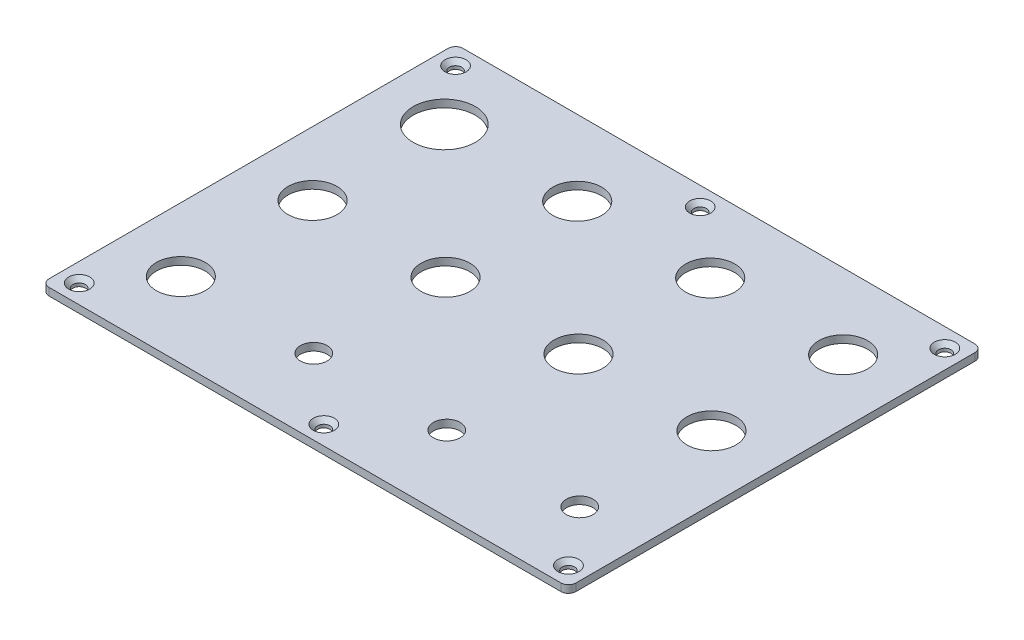
from build123d import *

# Parameters (mm, degrees)
BOTTOM_PLATE_W                       = 140
BOTTOM_PLATE_H                       = 110
BOTTOM_PLATE_EXT_DEPTH               = 2
TOP_ROW_R                            = 8.25
TOP_ROW_R_2                          = 6.5
TOP_ROW_CUT_DEPTH                    = 179.056170912
SKETCH2_R                            = 6.5
SKETCH2_R_2                          = 3.55
BOTTOM_ROW_CUT_DEPTH                 = 10
SKETCH3_R                            = 6.5
CENTER_ROW_CUT_DEPTH                 = 10
PLATE_SCREWS_R                       = 1.65
PLATE_SCREWS_CUT_DEPTH               = 179.056170912
PLATE_SCREW_HEAD_R                   = 2.8
PLATE_SCREW_HEAD_CUT_DEPTH           = 2
PLATE_SCREW_HEAD_CUT_DRAFT           = -45
PLATE_SCREW_HEAD_CUT_PROFILE_2_DEPTH = 2
PLATE_SCREW_HEAD_CUT_PROFILE_2_DRAFT = -45
PLATE_SCREW_HEAD_CUT_PROFILE_3_DEPTH = 2
PLATE_SCREW_HEAD_CUT_PROFILE_3_DRAFT = -45
PLATE_SCREW_HEAD_CUT_PROFILE_4_DEPTH = 2
PLATE_SCREW_HEAD_CUT_PROFILE_4_DRAFT = -45
PLATE_SCREW_HEAD_CUT_PROFILE_5_DEPTH = 2
PLATE_SCREW_HEAD_CUT_PROFILE_5_DRAFT = -45
PLATE_SCREW_HEAD_CUT_PROFILE_6_DEPTH = 2
PLATE_SCREW_HEAD_CUT_PROFILE_6_DRAFT = -45
FILLET1_R                            = 2
FILLET2_R                            = 2
FILLET3_R                            = 2
FILLET4_R                            = 2


with BuildPart() as part:
    # Bottom Plate → Bottom Plate EXT (new body)
    with BuildSketch(Plane(origin=(0, 0, 0), x_dir=(1, 0, 0), z_dir=(0, 1, 0))):
        with Locations((-70, 55)):
            Rectangle(BOTTOM_PLATE_W, BOTTOM_PLATE_H)
    extrude(amount=BOTTOM_PLATE_EXT_DEPTH)

    # Top Row → Top Row Cut (cut, through all)
    with BuildSketch(Plane(origin=(0, 2, 0), x_dir=(1, 0, 0), z_dir=(0, 1, 0))):
        with Locations(Location((-123, 90, 0), (0, 0, 270))):
            Circle(TOP_ROW_R)
        with Locations(Location((-87.666666667, 90, 0), (0, 0, 270))):
            Circle(TOP_ROW_R_2)
        with Locations(Location((-52.333333333, 90, 0), (0, 0, 270))):
            Circle(TOP_ROW_R_2)
        with Locations(Location((-17, 90, 0), (0, 0, 270))):
            Circle(TOP_ROW_R_2)
    extrude(amount=-TOP_ROW_CUT_DEPTH, mode=Mode.SUBTRACT)

    # Sketch2 → Bottom Row Cut (cut)
    with BuildSketch(Plane(origin=(0, 2, 0), x_dir=(1, 0, 0), z_dir=(0, 1, 0))):
        with Locations(Location((-123, 20, 0), (0, 0, 270))):
            Circle(SKETCH2_R)
        with Locations(Location((-87.666666667, 20, 0), (0, 0, 270))):
            Circle(SKETCH2_R_2)
        with Locations(Location((-52.333333333, 20, 0), (0, 0, 270))):
            Circle(SKETCH2_R_2)
        with Locations(Location((-17, 20, 0), (0, 0, 270))):
            Circle(SKETCH2_R_2)
    extrude(amount=-BOTTOM_ROW_CUT_DEPTH, mode=Mode.SUBTRACT)

    # Sketch3 → Center Row Cut (cut)
    with BuildSketch(Plane(origin=(0, 2, 0), x_dir=(1, 0, 0), z_dir=(0, 1, 0))):
        with Locations(Location((-123, 55, 0), (0, 0, 270))):
            Circle(SKETCH3_R)
        with Locations(Location((-87.666666667, 55, 0), (0, 0, 270))):
            Circle(SKETCH3_R)
        with Locations(Location((-52.333333333, 55, 0), (0, 0, 270))):
            Circle(SKETCH3_R)
        with Locations(Location((-17, 55, 0), (0, 0, 270))):
            Circle(SKETCH3_R)
    extrude(amount=-CENTER_ROW_CUT_DEPTH, mode=Mode.SUBTRACT)

    # Plate Screws → Plate Screws Cut (cut, through all)
    with BuildSketch(Plane(origin=(0, 2, 0), x_dir=(1, 0, 0), z_dir=(0, 1, 0))):
        with Locations(Location((-135, 105, 0), (0, 0, 270))):
            Circle(PLATE_SCREWS_R)
        with Locations(Location((-5, 105, 0), (0, 0, 270))):
            Circle(PLATE_SCREWS_R)
        with Locations(Location((-5, 5, 0), (0, 0, 270))):
            Circle(PLATE_SCREWS_R)
        with Locations(Location((-135, 5, 0), (0, 0, 270))):
            Circle(PLATE_SCREWS_R)
        with Locations(Location((-70, 105, 0), (0, 0, 270))):
            Circle(PLATE_SCREWS_R)
        with Locations(Location((-70, 5, 0), (0, 0, 90))):
            Circle(PLATE_SCREWS_R)
    extrude(amount=-PLATE_SCREWS_CUT_DEPTH, mode=Mode.SUBTRACT)


with BuildPart() as plate_screw_head_cut_tool:
    # Plate Screw Head → Plate Screw Head Cut (with draft: the straight prism first)
    with BuildSketch(Plane(origin=(0, 2, 0), x_dir=(1, 0, 0), z_dir=(0, 1, 0))):
        with Locations((-135, 105)):
            Circle(PLATE_SCREW_HEAD_R)
    extrude(amount=-PLATE_SCREW_HEAD_CUT_DEPTH)
    # Plate Screw Head Cut: the draft: its side faces are tilted about the plane it starts from
    plate_screw_head_cut_sides = [plate_screw_head_cut_tool.faces().sort_by_distance(p)[0] for p in [
        (-137.8, 1, -105),
    ]]
    draft(plate_screw_head_cut_sides, Plane(origin=(0, 2, 0), x_dir=(1, 0, 0), z_dir=(0, 1, 0)), PLATE_SCREW_HEAD_CUT_DRAFT)


with BuildPart() as part_1:
    add(part.part)

    # Plate Screw Head Cut: cut by plate_screw_head_cut_tool
    add(plate_screw_head_cut_tool.part, mode=Mode.SUBTRACT)


with BuildPart() as plate_screw_head_cut_profile_2_tool:
    # Plate Screw Head → Plate Screw Head Cut profile 2 (with draft: the straight prism first)
    with BuildSketch(Plane(origin=(0, 2, 0), x_dir=(1, 0, 0), z_dir=(0, 1, 0))):
        with Locations((-5, 105)):
            Circle(PLATE_SCREW_HEAD_R)
    extrude(amount=-PLATE_SCREW_HEAD_CUT_PROFILE_2_DEPTH)
    # Plate Screw Head Cut profile 2: the draft: its side faces are tilted about the plane it starts from
    plate_screw_head_cut_profile_2_sides = [plate_screw_head_cut_profile_2_tool.faces().sort_by_distance(p)[0] for p in [
        (-7.8, 1, -105),
    ]]
    draft(plate_screw_head_cut_profile_2_sides, Plane(origin=(0, 2, 0), x_dir=(1, 0, 0), z_dir=(0, 1, 0)), PLATE_SCREW_HEAD_CUT_PROFILE_2_DRAFT)


with BuildPart() as part_2:
    add(part_1.part)

    # Plate Screw Head Cut profile 2: cut by plate_screw_head_cut_profile_2_tool
    add(plate_screw_head_cut_profile_2_tool.part, mode=Mode.SUBTRACT)


with BuildPart() as plate_screw_head_cut_profile_3_tool:
    # Plate Screw Head → Plate Screw Head Cut profile 3 (with draft: the straight prism first)
    with BuildSketch(Plane(origin=(0, 2, 0), x_dir=(1, 0, 0), z_dir=(0, 1, 0))):
        with Locations((-5, 5)):
            Circle(PLATE_SCREW_HEAD_R)
    extrude(amount=-PLATE_SCREW_HEAD_CUT_PROFILE_3_DEPTH)
    # Plate Screw Head Cut profile 3: the draft: its side faces are tilted about the plane it starts from
    plate_screw_head_cut_profile_3_sides = [plate_screw_head_cut_profile_3_tool.faces().sort_by_distance(p)[0] for p in [
        (-7.8, 1, -5),
    ]]
    draft(plate_screw_head_cut_profile_3_sides, Plane(origin=(0, 2, 0), x_dir=(1, 0, 0), z_dir=(0, 1, 0)), PLATE_SCREW_HEAD_CUT_PROFILE_3_DRAFT)


with BuildPart() as part_3:
    add(part_2.part)

    # Plate Screw Head Cut profile 3: cut by plate_screw_head_cut_profile_3_tool
    add(plate_screw_head_cut_profile_3_tool.part, mode=Mode.SUBTRACT)


with BuildPart() as plate_screw_head_cut_profile_4_tool:
    # Plate Screw Head → Plate Screw Head Cut profile 4 (with draft: the straight prism first)
    with BuildSketch(Plane(origin=(0, 2, 0), x_dir=(1, 0, 0), z_dir=(0, 1, 0))):
        with Locations((-135, 5)):
            Circle(PLATE_SCREW_HEAD_R)
    extrude(amount=-PLATE_SCREW_HEAD_CUT_PROFILE_4_DEPTH)
    # Plate Screw Head Cut profile 4: the draft: its side faces are tilted about the plane it starts from
    plate_screw_head_cut_profile_4_sides = [plate_screw_head_cut_profile_4_tool.faces().sort_by_distance(p)[0] for p in [
        (-137.8, 1, -5),
    ]]
    draft(plate_screw_head_cut_profile_4_sides, Plane(origin=(0, 2, 0), x_dir=(1, 0, 0), z_dir=(0, 1, 0)), PLATE_SCREW_HEAD_CUT_PROFILE_4_DRAFT)


with BuildPart() as part_4:
    add(part_3.part)

    # Plate Screw Head Cut profile 4: cut by plate_screw_head_cut_profile_4_tool
    add(plate_screw_head_cut_profile_4_tool.part, mode=Mode.SUBTRACT)


with BuildPart() as plate_screw_head_cut_profile_5_tool:
    # Plate Screw Head → Plate Screw Head Cut profile 5 (with draft: the straight prism first)
    with BuildSketch(Plane(origin=(0, 2, 0), x_dir=(1, 0, 0), z_dir=(0, 1, 0))):
        with Locations((-70, 105)):
            Circle(PLATE_SCREW_HEAD_R)
    extrude(amount=-PLATE_SCREW_HEAD_CUT_PROFILE_5_DEPTH)
    # Plate Screw Head Cut profile 5: the draft: its side faces are tilted about the plane it starts from
    plate_screw_head_cut_profile_5_sides = [plate_screw_head_cut_profile_5_tool.faces().sort_by_distance(p)[0] for p in [
        (-72.8, 1, -105),
    ]]
    draft(plate_screw_head_cut_profile_5_sides, Plane(origin=(0, 2, 0), x_dir=(1, 0, 0), z_dir=(0, 1, 0)), PLATE_SCREW_HEAD_CUT_PROFILE_5_DRAFT)


with BuildPart() as part_5:
    add(part_4.part)

    # Plate Screw Head Cut profile 5: cut by plate_screw_head_cut_profile_5_tool
    add(plate_screw_head_cut_profile_5_tool.part, mode=Mode.SUBTRACT)


with BuildPart() as plate_screw_head_cut_profile_6_tool:
    # Plate Screw Head → Plate Screw Head Cut profile 6 (with draft: the straight prism first)
    with BuildSketch(Plane(origin=(0, 2, 0), x_dir=(1, 0, 0), z_dir=(0, 1, 0))):
        with Locations((-70, 5)):
            Circle(PLATE_SCREW_HEAD_R)
    extrude(amount=-PLATE_SCREW_HEAD_CUT_PROFILE_6_DEPTH)
    # Plate Screw Head Cut profile 6: the draft: its side faces are tilted about the plane it starts from
    plate_screw_head_cut_profile_6_sides = [plate_screw_head_cut_profile_6_tool.faces().sort_by_distance(p)[0] for p in [
        (-72.8, 1, -5),
    ]]
    draft(plate_screw_head_cut_profile_6_sides, Plane(origin=(0, 2, 0), x_dir=(1, 0, 0), z_dir=(0, 1, 0)), PLATE_SCREW_HEAD_CUT_PROFILE_6_DRAFT)


with BuildPart() as part_6:
    add(part_5.part)

    # Plate Screw Head Cut profile 6: cut by plate_screw_head_cut_profile_6_tool
    add(plate_screw_head_cut_profile_6_tool.part, mode=Mode.SUBTRACT)

    # Fillet1
    fillet1_edges = [part_6.edges().sort_by_distance(p)[0] for p in [
        (-140, 1, -110),
    ]]
    fillet(fillet1_edges, radius=FILLET1_R)

    # Fillet2
    fillet2_edges = [part_6.edges().sort_by_distance(p)[0] for p in [
        (0, 1, -110),
    ]]
    fillet(fillet2_edges, radius=FILLET2_R)

    # Fillet3
    fillet3_edges = [part_6.edges().sort_by_distance(p)[0] for p in [
        (0, 1, 0),
    ]]
    fillet(fillet3_edges, radius=FILLET3_R)

    # Fillet4
    fillet4_edges = [part_6.edges().sort_by_distance(p)[0] for p in [
        (-140, 1, 0),
    ]]
    fillet(fillet4_edges, radius=FILLET4_R)


solid = part_6.part
